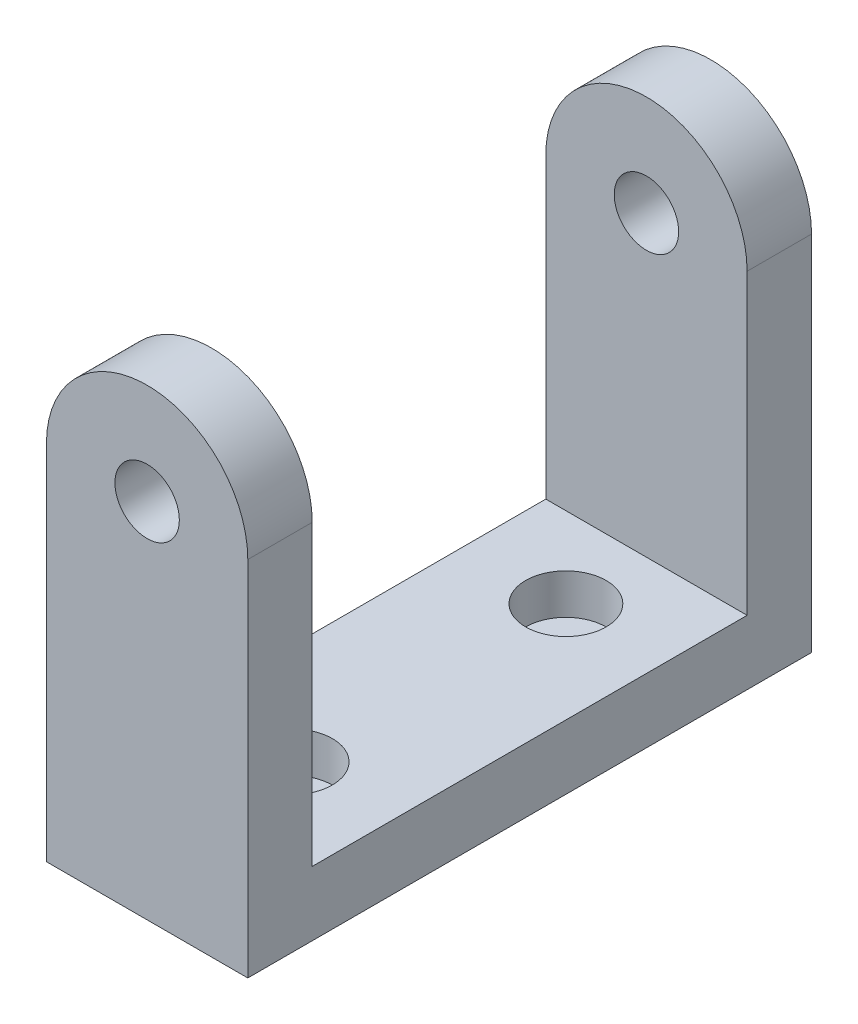
from build123d import *

# Parameters (mm, degrees)
IZIM1_W                     = 25
IZIM1_H                     = 57.5
Y_KSEKLIK_EKSTR_ZYON1_DEPTH = 70
RADYUS1_RADIUS              = 12.5
RADYUS1_LENGTH              = 70
IZIM3_W                     = 54
IZIM3_H                     = 49.5
KES_EKSTR_ZYON1_DEPTH       = 85.564510613
IZIM4_R                     = 5
KES_EKSTR_ZYON2_DEPTH       = 5
IZIM5_R                     = 4
KES_EKSTR_ZYON3_DEPTH       = 86.728971246


with BuildPart() as part:
    # Çizim1 → Yükseklik-Ekstrüzyon1 (new body)
    with BuildSketch(Plane.XY):
        with Locations((-16.193205739, 11.575630252)):
            Rectangle(IZIM1_W, IZIM1_H)
    extrude(amount=Y_KSEKLIK_EKSTR_ZYON1_DEPTH)

    # Radyus1: full round fillet: the end face becomes a half cylinder, R = half its width
    radyus1_face = Plane((-16.193205739, 40.325630252, 35), x_dir=(0, 0, 1), z_dir=(0, 1, 0))  # on the end face: x along it, z out of the body
    radyus1_slab = radyus1_face.offset(-RADYUS1_RADIUS / 2) * Box(RADYUS1_LENGTH, 2 * RADYUS1_RADIUS, RADYUS1_RADIUS, mode=Mode.PRIVATE)  # the body's end, R deep
    radyus1_round = Plane((-16.193205739, 27.825630252, 35), x_dir=(0, 1, 0), z_dir=(0, 0, 1)) * Cylinder(RADYUS1_RADIUS, RADYUS1_LENGTH, mode=Mode.PRIVATE)  # its axis R under the face
    add(radyus1_slab - radyus1_round, mode=Mode.SUBTRACT)

    # Çizim3 → Kes-Ekstrüzyon1 (cut, through all)
    with BuildSketch(Plane(origin=(-3.693205739, 0, 0), x_dir=(0, 0, -1), z_dir=(1, 0, 0))):
        with Locations((-35, 15.575630252)):
            Rectangle(IZIM3_W, IZIM3_H)
    extrude(amount=-KES_EKSTR_ZYON1_DEPTH, mode=Mode.SUBTRACT)

    # Çizim4 → Kes-Ekstrüzyon2 (cut)
    with BuildSketch(Plane(origin=(0, -9.174369748, 0), x_dir=(1, 0, 0), z_dir=(0, 1, 0))):
        with Locations(Location((-16.193205739, -18, 0), (0, 0, 180))):
            Circle(IZIM4_R)
        with Locations(Location((-16.193205739, -52, 0), (0, 0, 180))):
            Circle(IZIM4_R)
    extrude(amount=-KES_EKSTR_ZYON2_DEPTH, mode=Mode.SUBTRACT)

    # Çizim5 → Kes-Ekstrüzyon3 (cut, through all)
    with BuildSketch(Plane.XY.offset(70)):
        with Locations((-16.193205739, 27.825630252)):
            Circle(IZIM5_R)
    extrude(amount=-KES_EKSTR_ZYON3_DEPTH, mode=Mode.SUBTRACT)


solid = part.part
